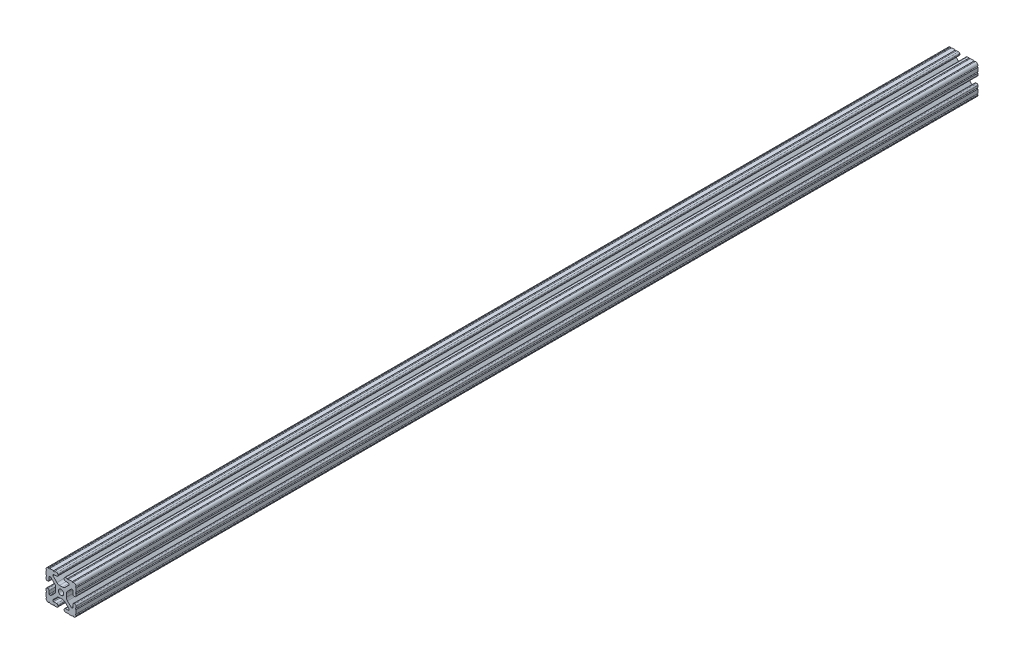
from build123d import *

# Parameters (mm, degrees)
SKETCH1_R      = 3.3274
EXTRUDE1_DEPTH = 1143


with BuildPart() as part:
    # Sketch1 → Extrude1 (new body)
    with BuildSketch(Plane.XY):
        with BuildLine():
            Line((-10.022898969, 12.91475973), (-5.252158105, 8.144007132))
            ThreePointArc((-5.252158105, 8.144007132), (-3.715177372, 7.117027388), (-1.902183975, 6.7564))
            Line((-1.902183975, 6.7564), (1.902183975, 6.7564))
            ThreePointArc((1.902183975, 6.7564), (3.715177372, 7.117027388), (5.252158105, 8.144007132))
            Line((5.252158105, 8.144007132), (10.022898969, 12.91475973))
            ThreePointArc((10.022898969, 12.91475973), (10.218362387, 13.207291992), (10.287, 13.552357131))
            Line((10.287, 13.552357131), (10.287, 14.0843))
            ThreePointArc((10.287, 14.0843), (10.022898185, 14.721898185), (9.3853, 14.986))
            Line((9.3853, 14.986), (5.617617549, 14.986))
            ThreePointArc((5.617617549, 14.986), (4.519044045, 15.441044045), (4.064, 16.539617549))
            Line((4.064, 16.539617549), (4.064, 17.496382451))
            ThreePointArc((4.064, 17.496382451), (4.519044045, 18.594955955), (5.617617549, 19.05))
            Line((5.617617549, 19.05), (7.974178704, 19.05))
            ThreePointArc((7.974178704, 19.05), (8.736178704, 18.288), (9.498178704, 19.05))
            Line((9.498178704, 19.05), (14.327719207, 19.05))
            ThreePointArc((14.327719207, 19.05), (15.087603123, 18.231251131), (15.847487039, 19.05))
            ThreePointArc((15.847487039, 19.05), (18.120176289, 18.120192083), (19.05, 15.847509295))
            ThreePointArc((19.05, 15.847509295), (18.231250992, 15.08762539), (19.05, 14.327741484))
            Line((19.05, 14.327741484), (19.05, 9.496091471))
            ThreePointArc((19.05, 9.496091471), (18.231250992, 8.736207565), (19.05, 7.97632366))
            Line((19.05, 7.97632366), (19.05, 5.617617549))
            ThreePointArc((19.05, 5.617617549), (18.594955955, 4.519044045), (17.496382451, 4.064))
            Line((17.496382451, 4.064), (16.539617549, 4.064))
            ThreePointArc((16.539617549, 4.064), (15.441044045, 4.519044045), (14.986, 5.617617549))
            Line((14.986, 5.617617549), (14.986, 9.385342516))
            ThreePointArc((14.986, 9.385342516), (14.721898185, 10.022940701), (14.0843, 10.287042516))
            Line((14.0843, 10.287042516), (13.516042086, 10.287042516))
            ThreePointArc((13.516042086, 10.287042516), (13.170975923, 10.218404478), (12.878443117, 10.022939917))
            Line((12.878443117, 10.022939917), (8.14758008, 5.292065243))
            ThreePointArc((8.14758008, 5.292065243), (7.117955879, 3.751120653), (6.7564, 1.933453584))
            Line((6.7564, 1.933453584), (6.7564, -1.933453584))
            ThreePointArc((6.7564, -1.933453584), (7.117955879, -3.751120653), (8.14758008, -5.292065243))
            Line((8.14758008, -5.292065243), (12.878443117, -10.022939917))
            ThreePointArc((12.878443117, -10.022939917), (13.170975923, -10.218404478), (13.516042086, -10.287042516))
            Line((13.516042086, -10.287042516), (14.0843, -10.287042516))
            ThreePointArc((14.0843, -10.287042516), (14.721898185, -10.022940701), (14.986, -9.385342516))
            Line((14.986, -9.385342516), (14.986, -5.617617549))
            ThreePointArc((14.986, -5.617617549), (15.441044045, -4.519044045), (16.539617549, -4.064))
            Line((16.539617549, -4.064), (17.496382451, -4.064))
            ThreePointArc((17.496382451, -4.064), (18.594955955, -4.519044045), (19.05, -5.617617549))
            Line((19.05, -5.617617549), (19.05, -7.976318491))
            ThreePointArc((19.05, -7.976318491), (18.231250992, -8.736202396), (19.05, -9.496086302))
            Line((19.05, -9.496086302), (19.05, -14.32774291))
            ThreePointArc((19.05, -14.32774291), (18.231250992, -15.087626816), (19.05, -15.847510721))
            ThreePointArc((19.05, -15.847510721), (18.120175716, -18.120192644), (15.847486868, -19.05))
            ThreePointArc((15.847486868, -19.05), (15.087602952, -18.231251131), (14.327719036, -19.05))
            Line((14.327719036, -19.05), (9.496062448, -19.05))
            ThreePointArc((9.496062448, -19.05), (8.736178532, -18.231251131), (7.976294616, -19.05))
            Line((7.976294616, -19.05), (5.617617549, -19.05))
            ThreePointArc((5.617617549, -19.05), (4.519044045, -18.594955955), (4.064, -17.496382451))
            Line((4.064, -17.496382451), (4.064, -16.539617549))
            ThreePointArc((4.064, -16.539617549), (4.519044045, -15.441044045), (5.617617549, -14.986))
            Line((5.617617549, -14.986), (9.3853, -14.986))
            ThreePointArc((9.3853, -14.986), (10.022898185, -14.721898185), (10.287, -14.0843))
            Line((10.287, -14.0843), (10.287, -13.552357131))
            ThreePointArc((10.287, -13.552357131), (10.218362387, -13.207291992), (10.022898969, -12.91475973))
            Line((10.022898969, -12.91475973), (5.252158105, -8.144007132))
            ThreePointArc((5.252158105, -8.144007132), (3.715177372, -7.117027388), (1.902183975, -6.7564))
            Line((1.902183975, -6.7564), (-1.902183975, -6.7564))
            ThreePointArc((-1.902183975, -6.7564), (-3.715177372, -7.117027388), (-5.252158105, -8.144007132))
            Line((-5.252158105, -8.144007132), (-10.022898969, -12.91475973))
            ThreePointArc((-10.022898969, -12.91475973), (-10.218362387, -13.207291992), (-10.287, -13.552357131))
            Line((-10.287, -13.552357131), (-10.287, -14.0843))
            ThreePointArc((-10.287, -14.0843), (-10.022898185, -14.721898185), (-9.3853, -14.986))
            Line((-9.3853, -14.986), (-5.617617549, -14.986))
            ThreePointArc((-5.617617549, -14.986), (-4.519044045, -15.441044045), (-4.064, -16.539617549))
            Line((-4.064, -16.539617549), (-4.064, -17.496382451))
            ThreePointArc((-4.064, -17.496382451), (-4.519044045, -18.594955955), (-5.617617549, -19.05))
            Line((-5.617617549, -19.05), (-7.976294616, -19.05))
            ThreePointArc((-7.976294616, -19.05), (-8.736178532, -18.231251131), (-9.496062448, -19.05))
            Line((-9.496062448, -19.05), (-14.327719036, -19.05))
            ThreePointArc((-14.327719036, -19.05), (-15.087602952, -18.231251131), (-15.847486868, -19.05))
            ThreePointArc((-15.847486868, -19.05), (-18.120175716, -18.120192644), (-19.05, -15.847510721))
            ThreePointArc((-19.05, -15.847510721), (-18.231250992, -15.087626816), (-19.05, -14.32774291))
            Line((-19.05, -14.32774291), (-19.05, -9.496086302))
            ThreePointArc((-19.05, -9.496086302), (-18.231250992, -8.736202396), (-19.05, -7.976318491))
            Line((-19.05, -7.976318491), (-19.05, -5.617617549))
            ThreePointArc((-19.05, -5.617617549), (-18.594955955, -4.519044045), (-17.496382451, -4.064))
            Line((-17.496382451, -4.064), (-16.539617549, -4.064))
            ThreePointArc((-16.539617549, -4.064), (-15.441044045, -4.519044045), (-14.986, -5.617617549))
            Line((-14.986, -5.617617549), (-14.986, -9.385342516))
            ThreePointArc((-14.986, -9.385342516), (-14.721898185, -10.022940701), (-14.0843, -10.287042516))
            Line((-14.0843, -10.287042516), (-13.516042086, -10.287042516))
            ThreePointArc((-13.516042086, -10.287042516), (-13.170975923, -10.218404478), (-12.878443117, -10.022939917))
            Line((-12.878443117, -10.022939917), (-8.14758008, -5.292065243))
            ThreePointArc((-8.14758008, -5.292065243), (-7.117955879, -3.751120653), (-6.7564, -1.933453584))
            Line((-6.7564, -1.933453584), (-6.7564, 1.933453584))
            ThreePointArc((-6.7564, 1.933453584), (-7.117955879, 3.751120653), (-8.14758008, 5.292065243))
            Line((-8.14758008, 5.292065243), (-12.878443117, 10.022939917))
            ThreePointArc((-12.878443117, 10.022939917), (-13.170975923, 10.218404478), (-13.516042086, 10.287042516))
            Line((-13.516042086, 10.287042516), (-14.0843, 10.287042516))
            ThreePointArc((-14.0843, 10.287042516), (-14.721898185, 10.022940701), (-14.986, 9.385342516))
            Line((-14.986, 9.385342516), (-14.986, 5.617617549))
            ThreePointArc((-14.986, 5.617617549), (-15.441044045, 4.519044045), (-16.539617549, 4.064))
            Line((-16.539617549, 4.064), (-17.496382451, 4.064))
            ThreePointArc((-17.496382451, 4.064), (-18.594955955, 4.519044045), (-19.05, 5.617617549))
            Line((-19.05, 5.617617549), (-19.05, 7.97632366))
            ThreePointArc((-19.05, 7.97632366), (-18.231250992, 8.736207565), (-19.05, 9.496091471))
            Line((-19.05, 9.496091471), (-19.05, 14.327741484))
            ThreePointArc((-19.05, 14.327741484), (-18.231250992, 15.08762539), (-19.05, 15.847509295))
            ThreePointArc((-19.05, 15.847509295), (-18.120176289, 18.120192083), (-15.847487039, 19.05))
            ThreePointArc((-15.847487039, 19.05), (-15.087603123, 18.231251131), (-14.327719207, 19.05))
            Line((-14.327719207, 19.05), (-9.498178704, 19.05))
            ThreePointArc((-9.498178704, 19.05), (-8.736178704, 18.288), (-7.974178704, 19.05))
            Line((-7.974178704, 19.05), (-5.617617549, 19.05))
            ThreePointArc((-5.617617549, 19.05), (-4.519044045, 18.594955955), (-4.064, 17.496382451))
            Line((-4.064, 17.496382451), (-4.064, 16.539617549))
            ThreePointArc((-4.064, 16.539617549), (-4.519044045, 15.441044045), (-5.617617549, 14.986))
            Line((-5.617617549, 14.986), (-9.3853, 14.986))
            ThreePointArc((-9.3853, 14.986), (-10.022898185, 14.721898185), (-10.287, 14.0843))
            Line((-10.287, 14.0843), (-10.287, 13.552357131))
            ThreePointArc((-10.287, 13.552357131), (-10.218362387, 13.207291992), (-10.022898969, 12.91475973))
        make_face()
        Circle(SKETCH1_R, mode=Mode.SUBTRACT)
    extrude(amount=-EXTRUDE1_DEPTH)


solid = part.part
